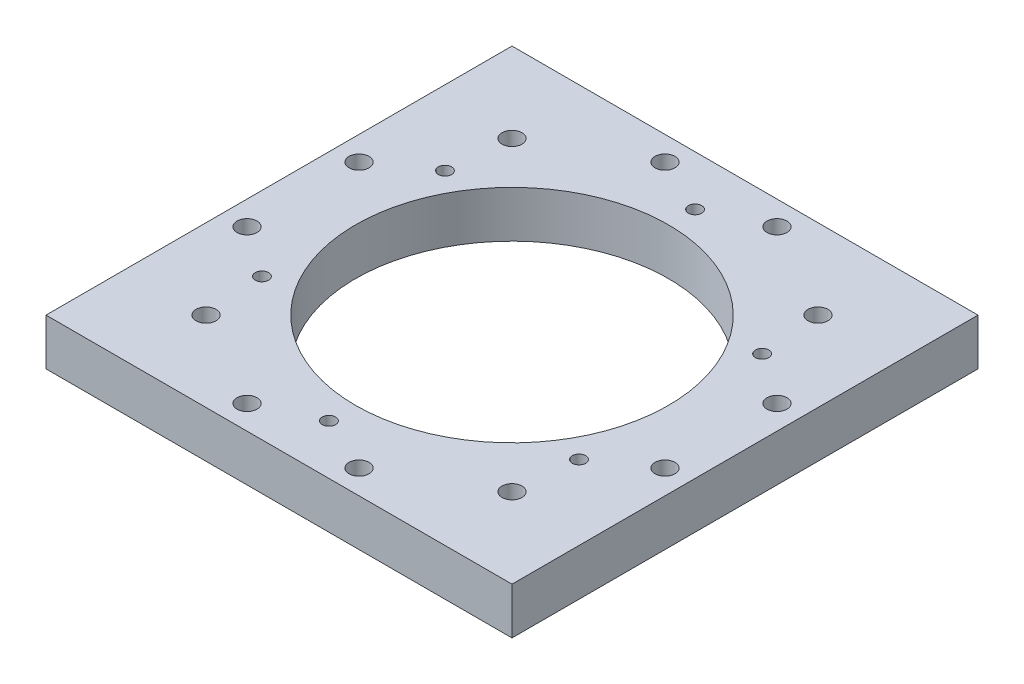
from build123d import *

# Parameters (mm, degrees)
SKETCH1_W           = 70
SKETCH1_H           = 70
SKETCH1_R           = 23.5
SKETCH1_R_2         = 1
SKETCH1_R_3         = 1.5
BOSS_EXTRUDE1_DEPTH = 7


with BuildPart() as part:
    # Sketch1 → Boss-Extrude1 (new body)
    with BuildSketch(Plane(origin=(0, 0, 0), x_dir=(1, 0, 0), z_dir=(0, 1, 0))):
        Rectangle(SKETCH1_W, SKETCH1_H)
        with Locations(Location((0, 0, 0), (0, 0, 270))):
            Circle(SKETCH1_R, mode=Mode.SUBTRACT)
        with Locations(Location((0, 27.5, 0), (0, 0, 270))):
            Circle(SKETCH1_R_2, mode=Mode.SUBTRACT)
        with Locations(Location((23.815698604, 13.75, 0), (0, 0, 270))):
            Circle(SKETCH1_R_2, mode=Mode.SUBTRACT)
        with Locations(Location((23.815698604, -13.75, 0), (0, 0, 270))):
            Circle(SKETCH1_R_2, mode=Mode.SUBTRACT)
        with Locations(Location((0, -27.5, 0), (0, 0, 270))):
            Circle(SKETCH1_R_2, mode=Mode.SUBTRACT)
        with Locations(Location((-23.815698604, -13.75, 0), (0, 0, 270))):
            Circle(SKETCH1_R_2, mode=Mode.SUBTRACT)
        with Locations(Location((-23.815698604, 13.75, 0), (0, 0, 270))):
            Circle(SKETCH1_R_2, mode=Mode.SUBTRACT)
        with Locations(Location((-31.392589354, -8.411618966, 0), (0, 0, 270))):
            Circle(SKETCH1_R_3, mode=Mode.SUBTRACT)
        with Locations(Location((-31.392589354, 8.411618966, 0), (0, 0, 270))):
            Circle(SKETCH1_R_3, mode=Mode.SUBTRACT)
        with Locations(Location((-22.980970389, 22.980970389, 0), (0, 0, 270))):
            Circle(SKETCH1_R_3, mode=Mode.SUBTRACT)
        with Locations(Location((-8.411618966, 31.392589354, 0), (0, 0, 270))):
            Circle(SKETCH1_R_3, mode=Mode.SUBTRACT)
        with Locations(Location((8.411618966, 31.392589354, 0), (0, 0, 270))):
            Circle(SKETCH1_R_3, mode=Mode.SUBTRACT)
        with Locations(Location((22.980970389, 22.980970389, 0), (0, 0, 270))):
            Circle(SKETCH1_R_3, mode=Mode.SUBTRACT)
        with Locations(Location((31.392589354, 8.411618966, 0), (0, 0, 270))):
            Circle(SKETCH1_R_3, mode=Mode.SUBTRACT)
        with Locations(Location((31.392589354, -8.411618966, 0), (0, 0, 270))):
            Circle(SKETCH1_R_3, mode=Mode.SUBTRACT)
        with Locations(Location((22.980970389, -22.980970389, 0), (0, 0, 270))):
            Circle(SKETCH1_R_3, mode=Mode.SUBTRACT)
        with Locations(Location((8.411618966, -31.392589354, 0), (0, 0, 270))):
            Circle(SKETCH1_R_3, mode=Mode.SUBTRACT)
        with Locations(Location((-8.411618966, -31.392589354, 0), (0, 0, 270))):
            Circle(SKETCH1_R_3, mode=Mode.SUBTRACT)
        with Locations(Location((-22.980970389, -22.980970389, 0), (0, 0, 270))):
            Circle(SKETCH1_R_3, mode=Mode.SUBTRACT)
    extrude(amount=BOSS_EXTRUDE1_DEPTH)


solid = part.part
